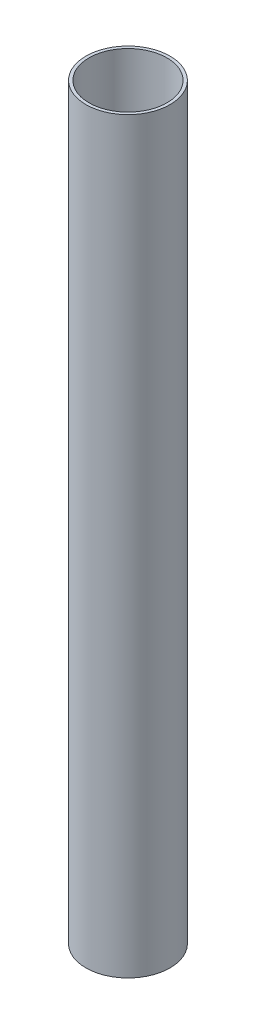
from build123d import *

# Parameters (mm, degrees)
SKETCH1_R           = 27.5
SKETCH1_R_2         = 25.5
BOSS_EXTRUDE1_DEPTH = 489


with BuildPart() as part:
    # Sketch1 → Boss-Extrude1 (new body)
    with BuildSketch(Plane(origin=(0, 0, 0), x_dir=(1, 0, 0), z_dir=(0, 1, 0))):
        with Locations(Location((0, 0, 0), (0, 0, 270))):
            Circle(SKETCH1_R)
        with Locations(Location((0, 0, 0), (0, 0, 270))):
            Circle(SKETCH1_R_2, mode=Mode.SUBTRACT)
    extrude(amount=BOSS_EXTRUDE1_DEPTH)


solid = part.part
